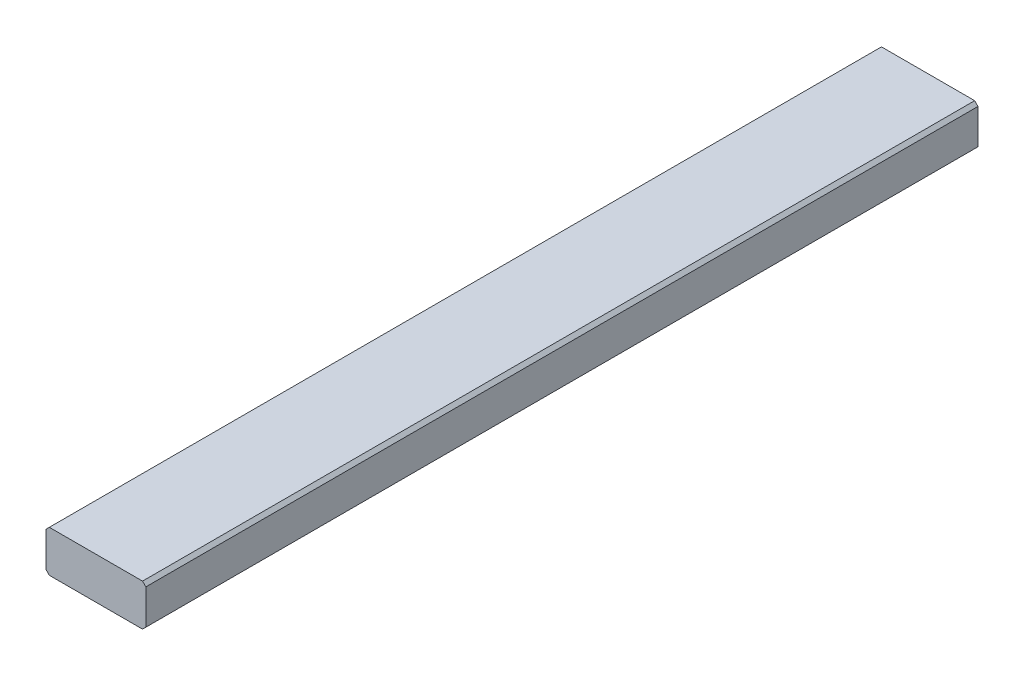
from build123d import *

# Parameters (mm, degrees)
EXTRUDE_1_DEPTH = 500


with BuildPart() as part:
    # Эскиз1 → Бобышка-Вытянуть1 (new body)
    with BuildSketch(Plane.XY):
        Polygon((-30, 10.5), (-28, 12.5), (28, 12.5), (30, 10.5), (30, -10.5), (28, -12.5), (-28, -12.5), (-30, -10.5), align=None)
    extrude(amount=EXTRUDE_1_DEPTH)


solid = part.part
